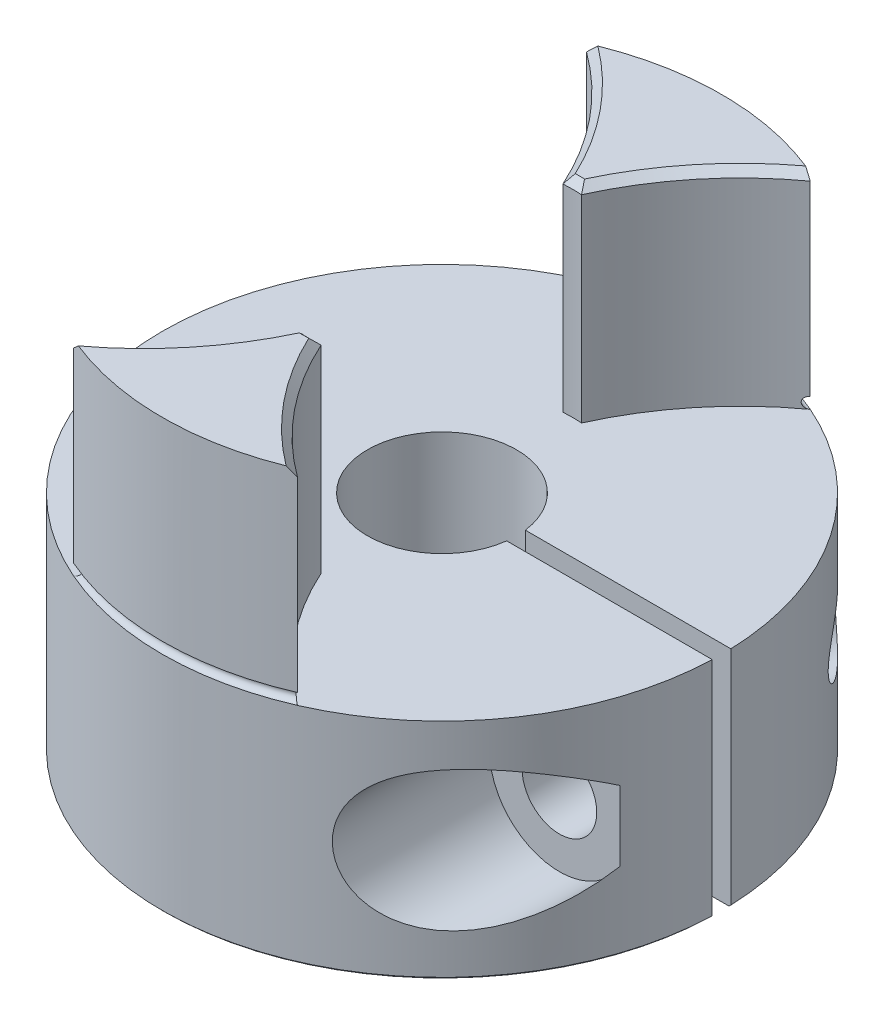
from build123d import *

# Parameters (mm, degrees)
SKETCH1_R                   = 15
BOSS_EXTRUDE1_DEPTH         = 11.5
SKETCH2_R                   = 7
CUT_EXTRUDE1_DEPTH          = 23
SKETCH3_R                   = 17
CUT_EXTRUDE2_DEPTH          = 11
CUT_EXTRUDE3_DEPTH          = 11
SKETCH5_W                   = 16.165630516
SKETCH5_H                   = 1
CUT_EXTRUDE4_DEPTH          = 21
SKETCH6_R                   = 2
CUT_EXTRUDE5_DEPTH          = 21
CUT_EXTRUDE6_START          = -4.2
SKETCH7_R                   = 3.75
CUT_EXTRUDE6_DEPTH          = 21
M4_TAPPED_HOLE1_D           = 3.3
M4_TAPPED_HOLE1_DEPTH       = 20.1
M4_TAPPED_HOLE1_TIP         = 0.991420021
CHAMFER1_SIZE               = 0.4
SKETCH10_R                  = 0.3
CHAMFER2_SIZE               = 0.1
Y_KSEKLIK_EKSTR_ZYON1_DEPTH = 12


with BuildPart() as part:
    # Sketch1 → Boss-Extrude1 (new, symmetric)
    with BuildSketch(Plane(origin=(0, 0, 0), x_dir=(1, 0, 0), z_dir=(0, 1, 0))):
        with Locations(Location((0, 0, 0), (0, 0, 270))):
            Circle(SKETCH1_R)
    extrude(amount=BOSS_EXTRUDE1_DEPTH, both=True)

    # Sketch2 → Cut-Extrude1 (cut)
    with BuildSketch(Plane(origin=(0, 11.5, 0), x_dir=(1, 0, 0), z_dir=(0, 1, 0))):
        with Locations(Location((0, 0, 0), (0, 0, 270))):
            Circle(SKETCH2_R)
    extrude(amount=-CUT_EXTRUDE1_DEPTH, mode=Mode.SUBTRACT)

    # Sketch3 → Cut-Extrude2 (cut)
    with BuildSketch(Plane(origin=(0, 11.5, 0), x_dir=(1, 0, 0), z_dir=(0, 1, 0))):
        with Locations((16, 0)):
            Circle(SKETCH3_R)
    extrude(amount=-CUT_EXTRUDE2_DEPTH, mode=Mode.SUBTRACT)

    # Sketch4 → Cut-Extrude3 (cut)
    with BuildSketch(Plane(origin=(0, 11.5, 0), x_dir=(1, 0, 0), z_dir=(0, 1, 0))):
        with BuildLine():
            ThreePointArc((-6, 13.747727085), (-15, 0), (-6, -13.747727085))
            ThreePointArc((-6, -13.747727085), (-2.808871931, -10.72353208), (-0.5, -6.982120022))
            ThreePointArc((-0.5, -6.982120022), (-7, 0), (-0.5, 6.982120022))
            ThreePointArc((-0.5, 6.982120022), (-2.808871931, 10.72353208), (-6, 13.747727085))
        make_face()
    extrude(amount=-CUT_EXTRUDE3_DEPTH, mode=Mode.SUBTRACT)

    # Sketch5 → Cut-Extrude4 (cut)
    with BuildSketch(Plane(origin=(0, 0.5, 0), x_dir=(1, 0, 0), z_dir=(0, 1, 0))):
        with Locations((11.807437966, 0)):
            Rectangle(SKETCH5_W, SKETCH5_H)
    extrude(amount=-CUT_EXTRUDE4_DEPTH, mode=Mode.SUBTRACT)

    # Sketch6 → Cut-Extrude5 (cut)
    with BuildSketch(Plane.XY):
        with Locations(Location((11, -5.5, 0), (0, 0, 180))):
            Circle(SKETCH6_R)
    extrude(amount=CUT_EXTRUDE5_DEPTH, mode=Mode.SUBTRACT)

    # Sketch7 → Cut-Extrude6 (cut)
    with BuildSketch(Plane(origin=(0, 0, 0.5), x_dir=(-1, 0, 0), z_dir=(0, 0, -1)).offset(CUT_EXTRUDE6_START)):
        with Locations((-11, -5.5)):
            Circle(SKETCH7_R)
    extrude(amount=-CUT_EXTRUDE6_DEPTH, mode=Mode.SUBTRACT)

    # M4 Tapped Hole1
    with Locations(Plane.XY.offset(-0.5)):
        with Locations((11, -5.5)):
            Hole(M4_TAPPED_HOLE1_D / 2, depth=M4_TAPPED_HOLE1_DEPTH)
            with Locations((0, 0, -(M4_TAPPED_HOLE1_DEPTH + M4_TAPPED_HOLE1_TIP / 2))):  # 118° drill point
                Cone(0, M4_TAPPED_HOLE1_D / 2, M4_TAPPED_HOLE1_TIP, mode=Mode.SUBTRACT)

    # Chamfer1
    chamfer1_edges = [part.edges().sort_by_distance(p)[0] for p in [
        (0, 11.5, -7),
        (2.808871931, 11.5, 10.72353208),
        (2.808871931, 11.5, -10.72353208),
        (0, 11.5, 7),
        (-2.808871931, 11.5, -10.72353208),
        (-2.808871931, 11.5, 10.72353208),
    ]]
    chamfer(chamfer1_edges, length=CHAMFER1_SIZE)

    # Sketch10 → Cut-Revolve1 (revolve, cut)
    with BuildSketch(Plane(origin=(0, 0, 0), x_dir=(0, 0, -1), z_dir=(1, 0, 0))):
        with Locations((15, 0.8)):
            Circle(SKETCH10_R)
    revolve(axis=Axis((0, 3.360414074, 0), (0, -1, 0)), mode=Mode.SUBTRACT)

    # Chamfer2
    chamfer2_edges = [part.edges().sort_by_distance(p)[0] for p in [
        (-15, -11.5, 0),
    ]]
    chamfer(chamfer2_edges, length=CHAMFER2_SIZE)

    # Çizim1 → Yükseklik-Ekstrüzyon1 (add)
    with BuildSketch(Plane(origin=(0, 0.5, 0), x_dir=(1, 0, 0), z_dir=(0, 1, 0))):
        with BuildLine():
            Line((6.982120022, 0.5), (3.968626967, 0.5))
            ThreePointArc((3.968626967, 0.5), (-4, 0), (3.968626967, -0.5))
            Line((3.968626967, -0.5), (6.982120022, -0.5))
            ThreePointArc((6.982120022, -0.5), (-7, 0), (6.982120022, 0.5))
        make_face()
    extrude(amount=-Y_KSEKLIK_EKSTR_ZYON1_DEPTH)


solid = part.part
